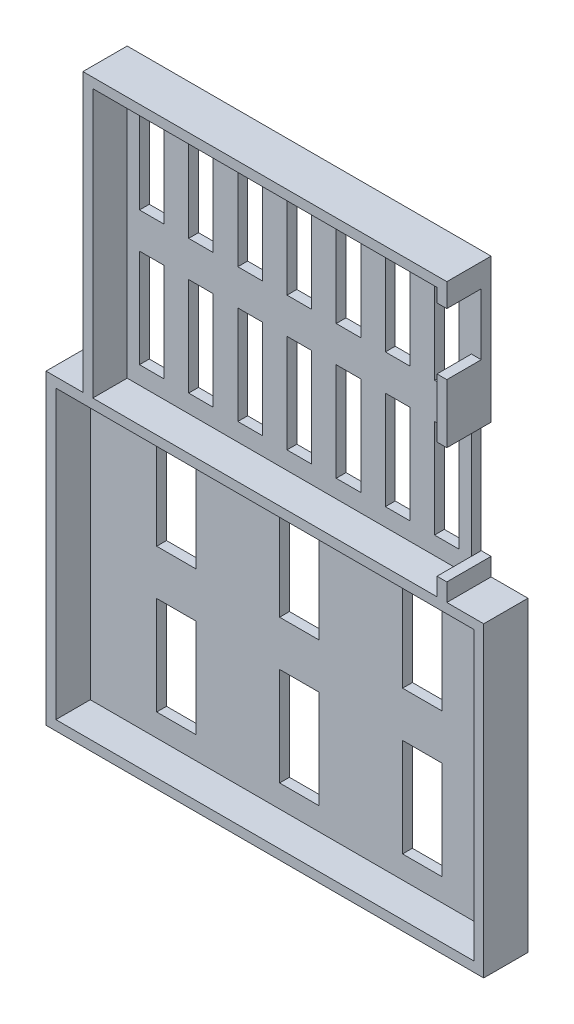
from build123d import *

# Parameters (mm, degrees)
SKETCH1_W             = 5
SKETCH1_H             = 20
BOSS_EXTRUDE1_DEPTH   = 2
SKETCH1_W_2           = 8
BOSS_EXTRUDE1_2_DEPTH = 2
SKETCH1_3_W           = 85
SKETCH1_3_H           = 58.381043258
SKETCH1_3_W_2         = 2
SKETCH1_3_H_2         = 12
BOSS_EXTRUDE2_DEPTH   = 9


with BuildPart() as part:
    # Sketch1 → Boss-Extrude1 (new body)
    with BuildSketch(Plane.XY):
        Polygon((37, 12), (37, 24.5), (35, 24.5), (35, 27.25), (0, 27.25), (-35, 27.25), (-35, -27.25), (35, -27.25), (35, 12), align=None)
        with Locations((-30, -13.625)):
            Rectangle(SKETCH1_W, SKETCH1_H, mode=Mode.SUBTRACT)
        with Locations((-20, -13.625)):
            Rectangle(SKETCH1_W, SKETCH1_H, mode=Mode.SUBTRACT)
        with Locations((-10, -13.625)):
            Rectangle(SKETCH1_W, SKETCH1_H, mode=Mode.SUBTRACT)
        with Locations((-30, 13.625)):
            Rectangle(SKETCH1_W, SKETCH1_H, mode=Mode.SUBTRACT)
        with Locations((-20, 13.625)):
            Rectangle(SKETCH1_W, SKETCH1_H, mode=Mode.SUBTRACT)
        with Locations((-10, 13.625)):
            Rectangle(SKETCH1_W, SKETCH1_H, mode=Mode.SUBTRACT)
        with Locations((0, -13.625)):
            Rectangle(SKETCH1_W, SKETCH1_H, mode=Mode.SUBTRACT)
        with Locations((10, -13.625)):
            Rectangle(SKETCH1_W, SKETCH1_H, mode=Mode.SUBTRACT)
        with Locations((20, -13.625)):
            Rectangle(SKETCH1_W, SKETCH1_H, mode=Mode.SUBTRACT)
        with Locations((30, -13.625)):
            Rectangle(SKETCH1_W, SKETCH1_H, mode=Mode.SUBTRACT)
        Polygon((-2.5, 23.625), (0, 23.625), (2.5, 23.625), (2.5, 3.625), (0, 3.625), (-2.5, 3.625), align=None, mode=Mode.SUBTRACT)
        with Locations((10, 13.625)):
            Rectangle(SKETCH1_W, SKETCH1_H, mode=Mode.SUBTRACT)
        with Locations((20, 13.625)):
            Rectangle(SKETCH1_W, SKETCH1_H, mode=Mode.SUBTRACT)
        with Locations((30, 13.625)):
            Rectangle(SKETCH1_W, SKETCH1_H, mode=Mode.SUBTRACT)
    extrude(amount=BOSS_EXTRUDE1_DEPTH)



with BuildPart() as body_2:
    # Sketch1 → Boss-Extrude1 2 (new body)
    with BuildSketch(Plane.XY):
        Polygon((0, -29.25), (-42.5, -29.25), (-42.5, -87.631043258), (42.5, -87.631043258), (42.5, -29.25), align=None)
        with Locations((-25, -73.035782443)):
            Rectangle(SKETCH1_W_2, SKETCH1_H, mode=Mode.SUBTRACT)
        with Locations((0, -73.035782443)):
            Rectangle(SKETCH1_W_2, SKETCH1_H, mode=Mode.SUBTRACT)
        with Locations((-25, -43.845260814)):
            Rectangle(SKETCH1_W_2, SKETCH1_H, mode=Mode.SUBTRACT)
        Polygon((-4, -33.845260814), (0, -33.845260814), (4, -33.845260814), (4, -53.845260814), (0, -53.845260814), (-4, -53.845260814), align=None, mode=Mode.SUBTRACT)
        with Locations((25, -73.035782443)):
            Rectangle(SKETCH1_W_2, SKETCH1_H, mode=Mode.SUBTRACT)
        with Locations((25, -43.845260814)):
            Rectangle(SKETCH1_W_2, SKETCH1_H, mode=Mode.SUBTRACT)
    extrude(amount=BOSS_EXTRUDE1_2_DEPTH)


with BuildPart() as part_1:
    add(part.part)

    add(body_2.part)  # Boss-Extrude2 merges body 2
    # Sketch1<3> → Boss-Extrude2 (add)
    # profile 1 of 2: a face of its own
    with BuildSketch(Plane.XY):
        Polygon((37, 29.25), (-37, 29.25), (-37, -27.25), (-44.5, -27.25), (-44.5, -89.631043258), (44.5, -89.631043258), (44.5, -27.25), (37, -27.25), (37, -23.625), (35, -23.625), (35, -27.25), (-35, -27.25), (-35, 27.25), (35, 27.25), (35, 24.5), (37, 24.5), align=None)
        with Locations((0, -58.440521629)):
            Rectangle(SKETCH1_3_W, SKETCH1_3_H, mode=Mode.SUBTRACT)
    # profile 2 of 2: a face of its own
    with BuildSketch(Plane.XY):
        with Locations((36, 6)):
            Rectangle(SKETCH1_3_W_2, SKETCH1_3_H_2)
    extrude(amount=BOSS_EXTRUDE2_DEPTH)


solid = part_1.part
